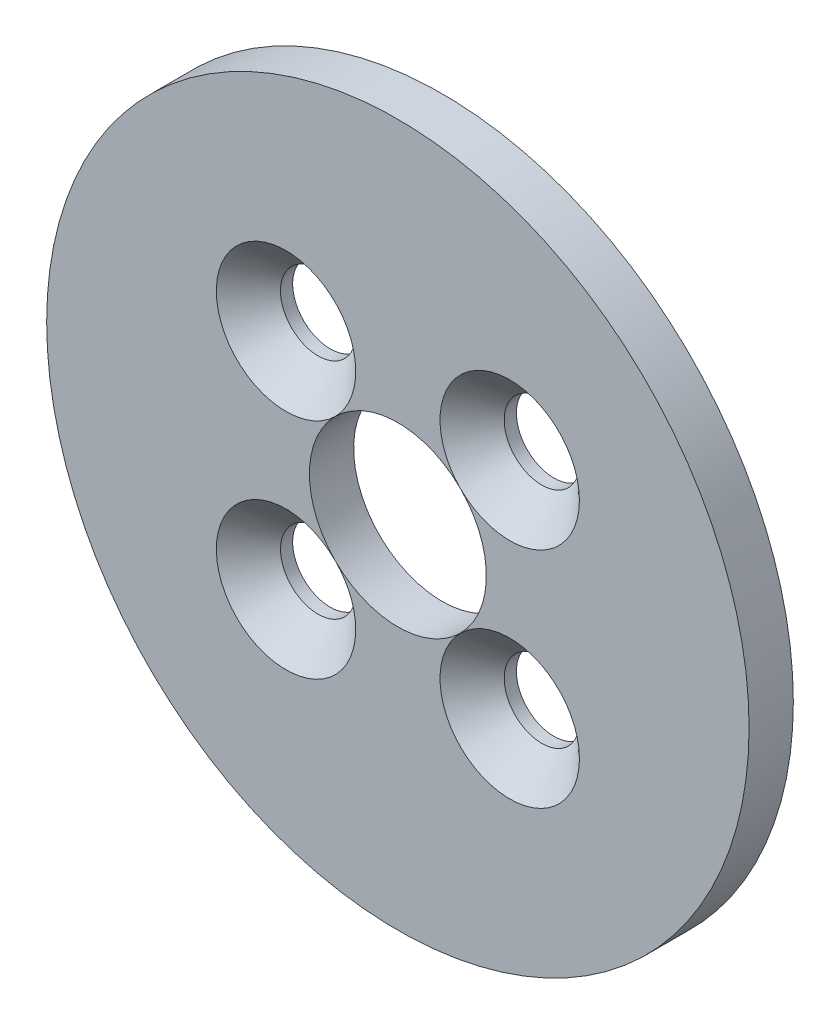
from build123d import *

# Parameters (mm, degrees)
SKETCH2_R                                      = 15.875
SKETCH2_R_2                                    = 1.7
SKETCH2_R_3                                    = 4
BOSS_EXTRUDE1_DEPTH                            = 2
CSK_FOR_M3_FLAT_HEAD_MACHINE_SCREW2_AT_2_COUNT = 2
CSK_FOR_M3_FLAT_HEAD_MACHINE_SCREW2_AT_2_PITCH = 10.111626971
CSK_FOR_M3_FLAT_HEAD_MACHINE_SCREW2_AT_3_COUNT = 2
CSK_FOR_M3_FLAT_HEAD_MACHINE_SCREW2_AT_3_PITCH = 14.3
CSK_FOR_M3_FLAT_HEAD_MACHINE_SCREW2_AT_4_COUNT = 2
CSK_FOR_M3_FLAT_HEAD_MACHINE_SCREW2_AT_4_PITCH = 10.111626971


with BuildPart() as part:
    # Sketch2 → Boss-Extrude1 (new body)
    with BuildSketch(Plane.XY):
        with Locations((-160.606756626, 98.885631483)):
            Circle(SKETCH2_R)
        with Locations((-165.662570112, 103.941444968)):
            Circle(SKETCH2_R_2, mode=Mode.SUBTRACT)
        with Locations((-155.550943141, 103.941444968)):
            Circle(SKETCH2_R_2, mode=Mode.SUBTRACT)
        with Locations((-155.550943141, 93.829817997)):
            Circle(SKETCH2_R_2, mode=Mode.SUBTRACT)
        with Locations((-165.662570112, 93.829817997)):
            Circle(SKETCH2_R_2, mode=Mode.SUBTRACT)
        with Locations((-160.606756626, 98.885631483)):
            Circle(SKETCH2_R_3, mode=Mode.SUBTRACT)
    extrude(amount=BOSS_EXTRUDE1_DEPTH)

    # Sketch4 → CSK for M3 Flat Head Machine Screw2 (revolve, cut)
    with BuildSketch(Plane(origin=(-165.662570112, 103.941444968, 2), x_dir=(0, -1, 0), z_dir=(1, 0, 0))):
        Polygon((0, 0), (0, 2), (1.7, 2), (1.7, 1.45), (3.15, 0), align=None)
    csk_for_m3_flat_head_machine_screw2 = revolve(axis=Axis((-165.662570112, 103.941444968, 8.35), (0, 0, -1)), mode=Mode.SUBTRACT)

    # CSK for M3 Flat Head Machine Screw2 at 2: CSK for M3 Flat Head Machine Screw2 ×2
    with Locations(*[(i * CSK_FOR_M3_FLAT_HEAD_MACHINE_SCREW2_AT_2_PITCH, 0, 0) for i in range(1, CSK_FOR_M3_FLAT_HEAD_MACHINE_SCREW2_AT_2_COUNT)]):
        add(csk_for_m3_flat_head_machine_screw2, mode=Mode.SUBTRACT)

    # CSK for M3 Flat Head Machine Screw2 at 3: CSK for M3 Flat Head Machine Screw2 ×2
    with Locations(*[Vector(0.7071067811865639, -0.7071067811865311, 0) * (i * CSK_FOR_M3_FLAT_HEAD_MACHINE_SCREW2_AT_3_PITCH) for i in range(1, CSK_FOR_M3_FLAT_HEAD_MACHINE_SCREW2_AT_3_COUNT)]):
        add(csk_for_m3_flat_head_machine_screw2, mode=Mode.SUBTRACT)

    # CSK for M3 Flat Head Machine Screw2 at 4: CSK for M3 Flat Head Machine Screw2 ×2
    with Locations(*[(0, -i * CSK_FOR_M3_FLAT_HEAD_MACHINE_SCREW2_AT_4_PITCH, 0) for i in range(1, CSK_FOR_M3_FLAT_HEAD_MACHINE_SCREW2_AT_4_COUNT)]):
        add(csk_for_m3_flat_head_machine_screw2, mode=Mode.SUBTRACT)


solid = part.part
